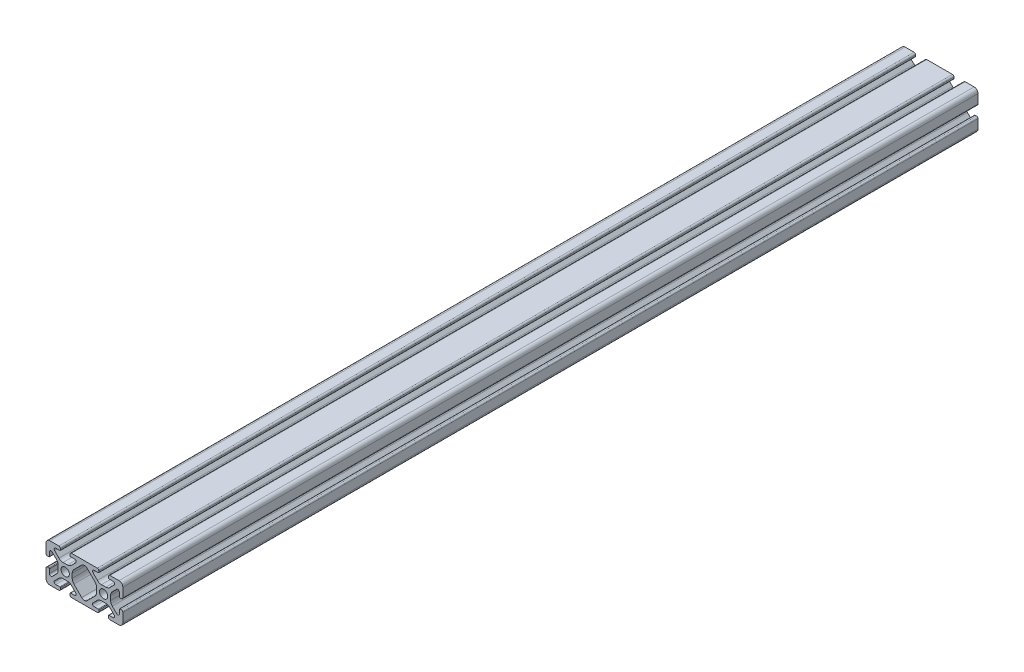
from build123d import *

# Parameters (mm, degrees)
ESQUISSE1_R      = 2.15
EXTRUSION1_DEPTH = 445.3


with BuildPart() as part:
    # Esquisse1 → Extrusion1 (new body)
    with BuildSketch(Plane(origin=(0, 0, 0), x_dir=(-1, 0, 0), z_dir=(0, 0, -1))):
        with BuildLine():
            Line((-38, 0), (-33.3, 0))
            ThreePointArc((-33.3, 0), (-32.734314575, 0.234314575), (-32.5, 0.8))
            Line((-32.5, 0.8), (-32.5, 1.5))
            ThreePointArc((-32.5, 1.5), (-32.587867966, 1.712132034), (-32.8, 1.8))
            Line((-32.8, 1.8), (-34.918424061, 1.8))
            ThreePointArc((-34.918424061, 1.8), (-35.686700051, 2.313345604), (-35.506437047, 3.219588924))
            Line((-35.506437047, 3.219588924), (-33.254705627, 5.471320344))
            ThreePointArc((-33.254705627, 5.471320344), (-32.281435581, 6.121638598), (-31.133385284, 6.35))
            Line((-31.133385284, 6.35), (-28.866614716, 6.35))
            ThreePointArc((-28.866614716, 6.35), (-27.718564419, 6.121638598), (-26.745294373, 5.471320344))
            Line((-26.745294373, 5.471320344), (-24.493562953, 3.219588924))
            ThreePointArc((-24.493562953, 3.219588924), (-24.313299949, 2.313345604), (-25.081575939, 1.8))
            Line((-25.081575939, 1.8), (-27.2, 1.8))
            ThreePointArc((-27.2, 1.8), (-27.412132034, 1.712132034), (-27.5, 1.5))
            Line((-27.5, 1.5), (-27.5, 0.8))
            ThreePointArc((-27.5, 0.8), (-27.265685425, 0.234314575), (-26.7, 0))
            Line((-26.7, 0), (-13.3, 0))
            ThreePointArc((-13.3, 0), (-12.734314575, 0.234314575), (-12.5, 0.8))
            Line((-12.5, 0.8), (-12.5, 1.5))
            ThreePointArc((-12.5, 1.5), (-12.587867966, 1.712132034), (-12.8, 1.8))
            Line((-12.8, 1.8), (-14.918424061, 1.8))
            ThreePointArc((-14.918424061, 1.8), (-15.686700051, 2.313345604), (-15.506437047, 3.219588924))
            Line((-15.506437047, 3.219588924), (-13.254705627, 5.471320344))
            ThreePointArc((-13.254705627, 5.471320344), (-12.281435581, 6.121638598), (-11.133385284, 6.35))
            Line((-11.133385284, 6.35), (-8.866614716, 6.35))
            ThreePointArc((-8.866614716, 6.35), (-7.718564419, 6.121638598), (-6.745294373, 5.471320344))
            Line((-6.745294373, 5.471320344), (-4.493562953, 3.219588924))
            ThreePointArc((-4.493562953, 3.219588924), (-4.313299949, 2.313345604), (-5.081575939, 1.8))
            Line((-5.081575939, 1.8), (-7.2, 1.8))
            ThreePointArc((-7.2, 1.8), (-7.412132034, 1.712132034), (-7.5, 1.5))
            Line((-7.5, 1.5), (-7.5, 0.8))
            ThreePointArc((-7.5, 0.8), (-7.265685425, 0.234314575), (-6.7, 0))
            Line((-6.7, 0), (-2, 0))
            ThreePointArc((-2, 0), (-0.585786438, 0.585786438), (0, 2))
            Line((0, 2), (0, 6.7))
            ThreePointArc((0, 6.7), (-0.234314575, 7.265685425), (-0.8, 7.5))
            Line((-0.8, 7.5), (-1.5, 7.5))
            ThreePointArc((-1.5, 7.5), (-1.712132034, 7.412132034), (-1.8, 7.2))
            Line((-1.8, 7.2), (-1.8, 5.081575939))
            ThreePointArc((-1.8, 5.081575939), (-2.313345604, 4.313299949), (-3.219588924, 4.493562953))
            Line((-3.219588924, 4.493562953), (-5.471320344, 6.745294373))
            ThreePointArc((-5.471320344, 6.745294373), (-6.121638598, 7.718564419), (-6.35, 8.866614716))
            Line((-6.35, 8.866614716), (-6.35, 11.133385284))
            ThreePointArc((-6.35, 11.133385284), (-6.121638598, 12.281435581), (-5.471320344, 13.254705627))
            Line((-5.471320344, 13.254705627), (-3.219588924, 15.506437047))
            ThreePointArc((-3.219588924, 15.506437047), (-2.313345604, 15.686700051), (-1.8, 14.918424061))
            Line((-1.8, 14.918424061), (-1.8, 12.8))
            ThreePointArc((-1.8, 12.8), (-1.712132034, 12.587867966), (-1.5, 12.5))
            Line((-1.5, 12.5), (-0.8, 12.5))
            ThreePointArc((-0.8, 12.5), (-0.234314575, 12.734314575), (0, 13.3))
            Line((0, 13.3), (0, 18))
            ThreePointArc((0, 18), (-0.585786438, 19.414213562), (-2, 20))
            Line((-2, 20), (-6.7, 20))
            ThreePointArc((-6.7, 20), (-7.265685425, 19.765685425), (-7.5, 19.2))
            Line((-7.5, 19.2), (-7.5, 18.5))
            ThreePointArc((-7.5, 18.5), (-7.412132034, 18.287867966), (-7.2, 18.2))
            Line((-7.2, 18.2), (-5.081575939, 18.2))
            ThreePointArc((-5.081575939, 18.2), (-4.313299949, 17.686654396), (-4.493562953, 16.780411076))
            Line((-4.493562953, 16.780411076), (-6.745294373, 14.528679656))
            ThreePointArc((-6.745294373, 14.528679656), (-7.718564419, 13.878361402), (-8.866614716, 13.65))
            Line((-8.866614716, 13.65), (-11.133385284, 13.65))
            ThreePointArc((-11.133385284, 13.65), (-12.281435581, 13.878361402), (-13.254705627, 14.528679656))
            Line((-13.254705627, 14.528679656), (-15.506437047, 16.780411076))
            ThreePointArc((-15.506437047, 16.780411076), (-15.686700051, 17.686654396), (-14.918424061, 18.2))
            Line((-14.918424061, 18.2), (-12.8, 18.2))
            ThreePointArc((-12.8, 18.2), (-12.587867966, 18.287867966), (-12.5, 18.5))
            Line((-12.5, 18.5), (-12.5, 19.2))
            ThreePointArc((-12.5, 19.2), (-12.734314575, 19.765685425), (-13.3, 20))
            Line((-13.3, 20), (-26.7, 20))
            ThreePointArc((-26.7, 20), (-27.265685425, 19.765685425), (-27.5, 19.2))
            Line((-27.5, 19.2), (-27.5, 18.5))
            ThreePointArc((-27.5, 18.5), (-27.412132034, 18.287867966), (-27.2, 18.2))
            Line((-27.2, 18.2), (-25.081575939, 18.2))
            ThreePointArc((-25.081575939, 18.2), (-24.313299949, 17.686654396), (-24.493562953, 16.780411076))
            Line((-24.493562953, 16.780411076), (-26.745294373, 14.528679656))
            ThreePointArc((-26.745294373, 14.528679656), (-27.718564419, 13.878361402), (-28.866614716, 13.65))
            Line((-28.866614716, 13.65), (-31.133385284, 13.65))
            ThreePointArc((-31.133385284, 13.65), (-32.281435581, 13.878361402), (-33.254705627, 14.528679656))
            Line((-33.254705627, 14.528679656), (-35.506437047, 16.780411076))
            ThreePointArc((-35.506437047, 16.780411076), (-35.686700051, 17.686654396), (-34.918424061, 18.2))
            Line((-34.918424061, 18.2), (-32.8, 18.2))
            ThreePointArc((-32.8, 18.2), (-32.587867966, 18.287867966), (-32.5, 18.5))
            Line((-32.5, 18.5), (-32.5, 19.2))
            ThreePointArc((-32.5, 19.2), (-32.734314575, 19.765685425), (-33.3, 20))
            Line((-33.3, 20), (-38, 20))
            ThreePointArc((-38, 20), (-39.414213562, 19.414213562), (-40, 18))
            Line((-40, 18), (-40, 13.3))
            ThreePointArc((-40, 13.3), (-39.765685425, 12.734314575), (-39.2, 12.5))
            Line((-39.2, 12.5), (-38.5, 12.5))
            ThreePointArc((-38.5, 12.5), (-38.287867966, 12.587867966), (-38.2, 12.8))
            Line((-38.2, 12.8), (-38.2, 14.918424061))
            ThreePointArc((-38.2, 14.918424061), (-37.686654396, 15.686700051), (-36.780411076, 15.506437047))
            Line((-36.780411076, 15.506437047), (-34.528679656, 13.254705627))
            ThreePointArc((-34.528679656, 13.254705627), (-33.878361402, 12.281435581), (-33.65, 11.133385284))
            Line((-33.65, 11.133385284), (-33.65, 8.866614716))
            ThreePointArc((-33.65, 8.866614716), (-33.878361402, 7.718564419), (-34.528679656, 6.745294373))
            Line((-34.528679656, 6.745294373), (-36.780411076, 4.493562953))
            ThreePointArc((-36.780411076, 4.493562953), (-37.686654396, 4.313299949), (-38.2, 5.081575939))
            Line((-38.2, 5.081575939), (-38.2, 7.2))
            ThreePointArc((-38.2, 7.2), (-38.287867966, 7.412132034), (-38.5, 7.5))
            Line((-38.5, 7.5), (-39.2, 7.5))
            ThreePointArc((-39.2, 7.5), (-39.765685425, 7.265685425), (-40, 6.7))
            Line((-40, 6.7), (-40, 2))
            ThreePointArc((-40, 2), (-39.414213562, 0.585786438), (-38, 0))
        make_face()
        with Locations(Location((-10, 10, 0), (0, 0, 180))):
            Circle(ESQUISSE1_R, mode=Mode.SUBTRACT)
        with Locations(Location((-30, 10, 0), (0, 0, 180))):
            Circle(ESQUISSE1_R, mode=Mode.SUBTRACT)
        with BuildLine():
            Line((-13.650001154, 11.134569154), (-13.650001154, 8.865431094))
            ThreePointArc((-13.650001154, 8.865431094), (-13.878362476, 7.717381202), (-14.5286805, 6.7441115))
            Line((-14.5286805, 6.7441115), (-18.585786, 2.687006))
            ThreePointArc((-18.585786, 2.687006), (-19.999999562, 2.101219562), (-21.414213125, 2.687006))
            Line((-21.414213125, 2.687006), (-25.471320125, 6.744113))
            ThreePointArc((-25.471320125, 6.744113), (-26.121638379, 7.717383046), (-26.349999781, 8.865433344))
            Line((-26.349999781, 8.865433344), (-26.349999781, 11.134567344))
            ThreePointArc((-26.349999781, 11.134567344), (-26.121638308, 12.282617811), (-25.471319863, 13.255887949))
            Line((-25.471319863, 13.255887949), (-21.41421295, 17.312993861))
            ThreePointArc((-21.41421295, 17.312993861), (-19.999999562, 17.898780125), (-18.585786174, 17.312993861))
            Line((-18.585786174, 17.312993861), (-14.528681072, 13.255889759))
            ThreePointArc((-14.528681072, 13.255889759), (-13.878362627, 12.282619622), (-13.650001154, 11.134569154))
        make_face(mode=Mode.SUBTRACT)
    extrude(amount=-EXTRUSION1_DEPTH)


solid = part.part
